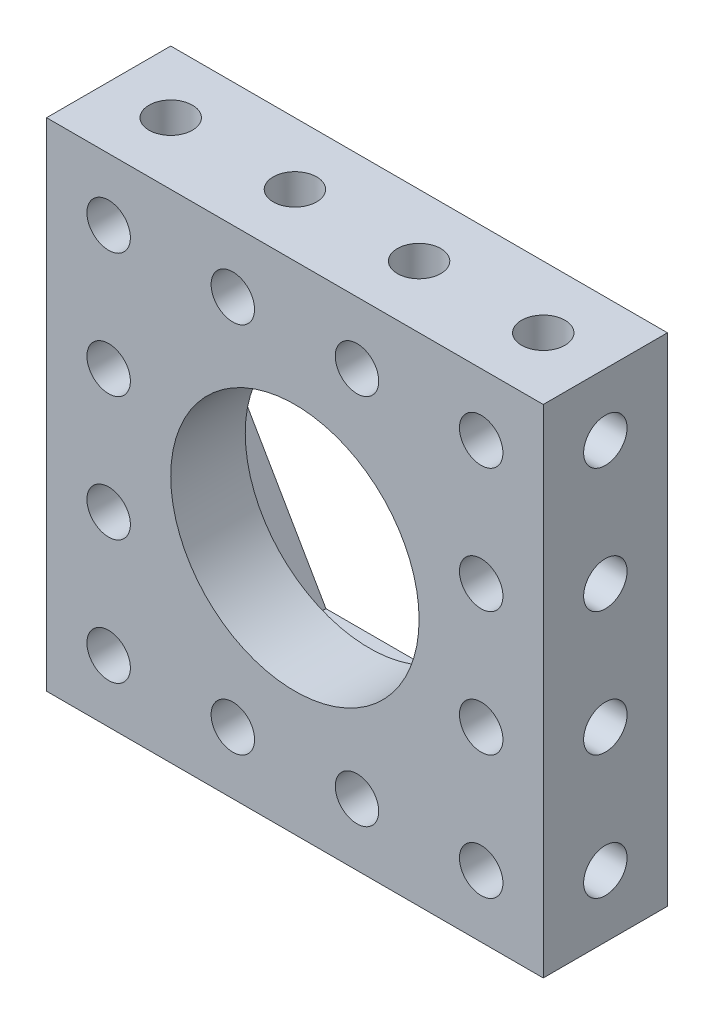
from build123d import *

# Parameters (mm, degrees)
ESQUISSE1_W                   = 40
ESQUISSE1_H                   = 40
BOSS_EXTRU_1_DEPTH            = 10
BOSS_EXTRU_2_START            = 4
ESQUISSE1_3_R                 = 10
BOSS_EXTRU_2_DEPTH            = 6
ENL_V_MAT_EXTRU_3_DEPTH       = 46.82575695
ENL_V_MAT_EXTRU_3_DEPTH_BACK  = 46.82575695
ESQUISSE6_R                   = 1.75
ENL_V_MAT_EXTRU_10_DEPTH      = 46.825757059
ENL_V_MAT_EXTRU_10_DEPTH_BACK = 46.825757059
ESQUISSE9_R                   = 1.75
ESQUISSE11_R                  = 1.75
ENL_V_MAT_EXTRU_13_DEPTH      = 58.445626465
BOSS_EXTRU_3_START            = -4
ESQUISSE12_R                  = 10
BOSS_EXTRU_3_DEPTH            = 6


with BuildPart() as part:
    # Esquisse1 → Boss.-Extru.1 (new body)
    with BuildSketch(Plane.XY):
        with Locations((20, 20)):
            Rectangle(ESQUISSE1_W, ESQUISSE1_H)
        Polygon((27.5, 7.009618943), (35, 20), (27.5, 32.990381057), (12.5, 32.990381057), (5, 20), (12.5, 7.009618943), align=None, mode=Mode.SUBTRACT)
    extrude(amount=BOSS_EXTRU_1_DEPTH)

    # Esquisse1<3> → Boss.-Extru.2 (add)
    with BuildSketch(Plane.XY.offset(BOSS_EXTRU_2_START)):
        Polygon((12.5, 7.009618943), (27.5, 7.009618943), (35, 20), (27.5, 32.990381057), (12.5, 32.990381057), (5, 20), align=None)
        with Locations(Location((20, 20, 0), (0, 0, 180))):
            Circle(ESQUISSE1_3_R, mode=Mode.SUBTRACT)
    extrude(amount=BOSS_EXTRU_2_DEPTH)

    # Esquisse6 → Enlèv. mat.-Extru.3 (cut, two sides: drawn at the far end of the back side and taken through both)
    with BuildSketch(Plane(origin=(0, 20, 0), x_dir=(-1, 0, 0), z_dir=(0, -1, 0)).offset(-ENL_V_MAT_EXTRU_3_DEPTH_BACK)):
        with Locations(Location((-5, -5, 0), (0, 0, 90))):
            Circle(ESQUISSE6_R)
        with Locations(Location((-15, -5, 0), (0, 0, 90))):
            Circle(ESQUISSE6_R)
        with Locations(Location((-25, -5, 0), (0, 0, 90))):
            Circle(ESQUISSE6_R)
        with Locations(Location((-35, -5, 0), (0, 0, 90))):
            Circle(ESQUISSE6_R)
    extrude(amount=ENL_V_MAT_EXTRU_3_DEPTH + ENL_V_MAT_EXTRU_3_DEPTH_BACK, mode=Mode.SUBTRACT)

    # Esquisse9 → Enlèv. mat.-Extru.10 (cut, two sides: drawn at the far end of the back side and taken through both)
    with BuildSketch(Plane(origin=(20, 0, 0), x_dir=(0, 0, -1), z_dir=(1, 0, 0)).offset(-ENL_V_MAT_EXTRU_10_DEPTH_BACK)):
        with Locations(Location((-5, 35, 0), (0, 0, 45))):
            Circle(ESQUISSE9_R)
        with Locations(Location((-5, 25, 0), (0, 0, 315))):
            Circle(ESQUISSE9_R)
        with Locations(Location((-5, 15, 0), (0, 0, 45))):
            Circle(ESQUISSE9_R)
        with Locations(Location((-5, 5, 0), (0, 0, 45))):
            Circle(ESQUISSE9_R)
    extrude(amount=ENL_V_MAT_EXTRU_10_DEPTH + ENL_V_MAT_EXTRU_10_DEPTH_BACK, mode=Mode.SUBTRACT)

    # Esquisse11 → Enlèv. mat.-Extru.13 (cut, through all)
    with BuildSketch(Plane.XY.offset(10)):
        with Locations((5, 5)):
            Circle(ESQUISSE11_R)
        with Locations((15, 5)):
            Circle(ESQUISSE11_R)
        with Locations((25, 5)):
            Circle(ESQUISSE11_R)
        with Locations((35, 5)):
            Circle(ESQUISSE11_R)
        with Locations((25, 15)):
            Circle(ESQUISSE11_R)
        with Locations((35, 15)):
            Circle(ESQUISSE11_R)
        with Locations((25, 25)):
            Circle(ESQUISSE11_R)
        with Locations((35, 25)):
            Circle(ESQUISSE11_R)
        with Locations((25, 35)):
            Circle(ESQUISSE11_R)
        with Locations((35, 35)):
            Circle(ESQUISSE11_R)
        with Locations((15, 35)):
            Circle(ESQUISSE11_R)
        with Locations((5, 15)):
            Circle(ESQUISSE11_R)
        with Locations((5, 25)):
            Circle(ESQUISSE11_R)
        with Locations((5, 35)):
            Circle(ESQUISSE11_R)
    extrude(amount=-ENL_V_MAT_EXTRU_13_DEPTH, mode=Mode.SUBTRACT)

    # Esquisse12 → Boss.-Extru.3 (add)
    with BuildSketch(Plane(origin=(0, 0, 0), x_dir=(-1, 0, 0), z_dir=(0, 0, -1)).offset(BOSS_EXTRU_3_START)):
        Polygon((-35, 20), (-27.5, 7.009618943), (-12.5, 7.009618943), (-5, 20), (-12.5, 32.990381057), (-27.5, 32.990381057), align=None)
        with Locations((-20, 20)):
            Circle(ESQUISSE12_R, mode=Mode.SUBTRACT)
    extrude(amount=-BOSS_EXTRU_3_DEPTH)


solid = part.part
